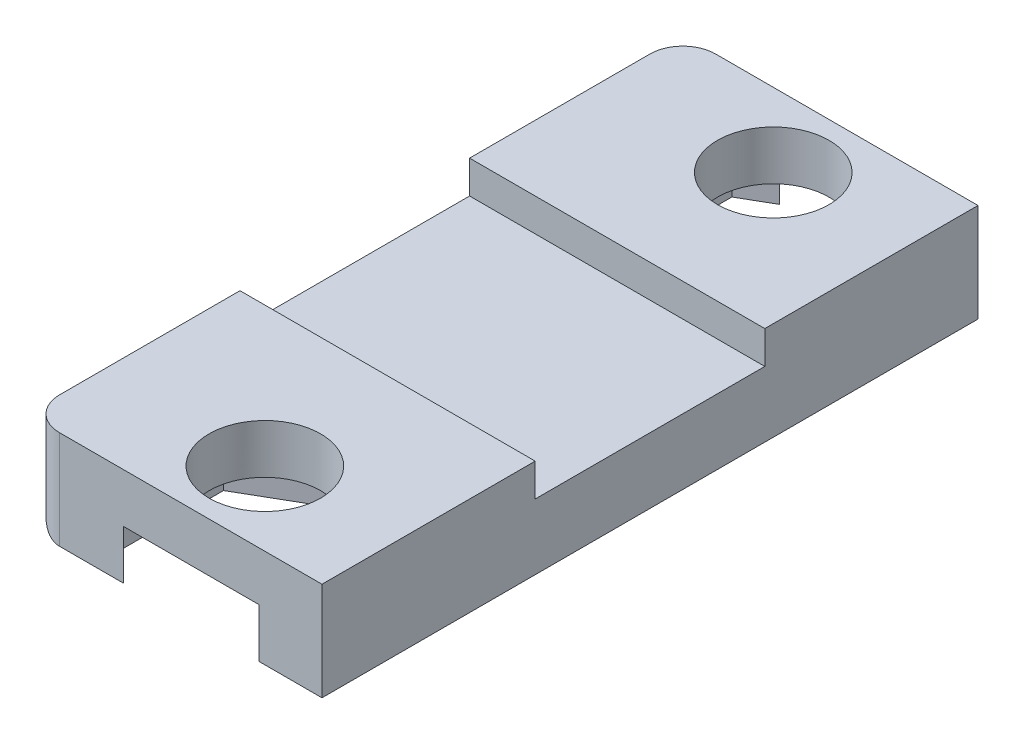
from build123d import *

# Parameters (mm, degrees)
CROQUIS1_W              = 9
CROQUIS1_H              = 20
CROQUIS1_R              = 1.7
SALIENTE_EXTRUIR1_DEPTH = 3
CORTAR_EXTRUIR2_DEPTH   = 1.5
CORTAR_EXTRUIR3_REACH   = 25.958
CROQUIS3_W              = 7
CROQUIS3_H              = 1
REDONDEO1_R             = 1


with BuildPart() as part:
    # Croquis1 → Saliente-Extruir1 (new body)
    with BuildSketch(Plane(origin=(0, 0, 0), x_dir=(1, 0, 0), z_dir=(0, 1, 0))):
        with Locations((165.454426616, -12)):
            Rectangle(CROQUIS1_W, CROQUIS1_H)
        with Locations(Location((165.962302832, -4.25, 0), (0, 0, 270))):
            Circle(CROQUIS1_R, mode=Mode.SUBTRACT)
        with Locations(Location((165.962302832, -19.75, 0), (0, 0, 270))):
            Circle(CROQUIS1_R, mode=Mode.SUBTRACT)
    extrude(amount=-SALIENTE_EXTRUIR1_DEPTH)

    # Croquis2 → Cortar-Extruir2 (cut)
    with BuildSketch(Plane.XZ.offset(3)):
        Polygon((168.943819954, 21.471379713), (165.962302832, 23.192759426), (162.98078571, 21.471379713), (162.98078571, 18.028620287), (165.962302832, 16.307240574), (168.943819954, 18.028620287), align=None)
        Polygon((168.943819954, 5.971379713), (168.943819954, 2.528620287), (165.962302832, 0.807240574), (162.98078571, 2.528620287), (162.98078571, 5.971379713), (165.962302832, 7.692759426), align=None)
    extrude(amount=-CORTAR_EXTRUIR2_DEPTH, mode=Mode.SUBTRACT)

    # Croquis3 → Cortar-Extruir3 (cut, up to next)
    with BuildSketch(Plane.ZY.offset(-160.954426616), mode=Mode.PRIVATE) as cortar_extruir3_sk1:
        with Locations((12, -0.5)):
            Rectangle(CROQUIS3_W, CROQUIS3_H)
    cortar_extruir3_tool1 = extrude(cortar_extruir3_sk1.sketch, amount=-CORTAR_EXTRUIR3_REACH, mode=Mode.PRIVATE) & part.part
    add(cortar_extruir3_tool1.solids().sort_by_distance((160.954427, -0.5, 12))[0], mode=Mode.SUBTRACT)

    # Redondeo1
    redondeo1_edges = [part.edges().sort_by_distance(p)[0] for p in [
        (160.954426616, -3, 12),
        (160.954426616, -1.5, 2),
        (160.954426616, -1.5, 22),
    ]]
    fillet(redondeo1_edges, radius=REDONDEO1_R)


solid = part.part
